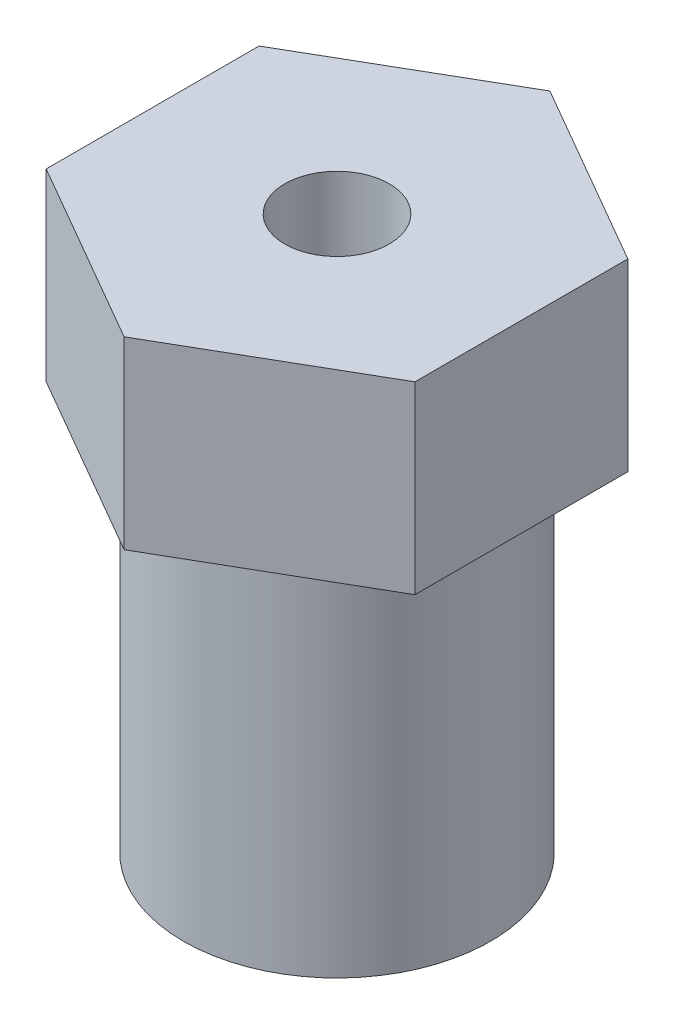
from build123d import *

# Parameters (mm, degrees)
SKETCH1_R                 = 5
SKETCH1_R_2               = 3
BOSS_EXTRUDE1_DEPTH       = 14
BOSS_EXTRUDE2_DEPTH       = 4
M3_CLEARANCE_HOLE1_D      = 3.4
M3_CLEARANCE_HOLE2_REACH  = 25.495
M3_CLEARANCE_HOLE2_BORE_R = 1.7
BOSS_EXTRUDE3_REACH       = 25.495
BOSS_EXTRUDE3_END_RADIUS  = 5
SKETCH11_R                = 2.549362178
SKETCH11_R_2              = 1.7
SKETCH14_R                = 2.549362178
CUT_EXTRUDE2_DEPTH        = 1
BOSS_EXTRUDE4_DEPTH       = 2


with BuildPart() as part:
    # Sketch1 → Boss-Extrude1 (new body)
    with BuildSketch(Plane(origin=(0, 0, 0), x_dir=(1, 0, 0), z_dir=(0, 1, 0))):
        with Locations(Location((0, 0, 0), (0, 0, 270))):
            Circle(SKETCH1_R)
        with Locations(Location((0, 0, 0), (0, 0, 270))):
            Circle(SKETCH1_R_2, mode=Mode.SUBTRACT)
    extrude(amount=BOSS_EXTRUDE1_DEPTH)

    # Sketch2 → Boss-Extrude2 (add)
    with BuildSketch(Plane(origin=(0, 14, 0), x_dir=(1, 0, 0), z_dir=(0, 1, 0))):
        Polygon((0, 6.92820323), (-6, 3.464101615), (-6, -3.464101615), (0, -6.92820323), (6, -3.464101615), (6, 3.464101615), align=None)
    extrude(amount=BOSS_EXTRUDE2_DEPTH)

    # M3 Clearance Hole1 (through all)
    with Locations(Plane(origin=(0, 18, 0), x_dir=(1, 0, 0), z_dir=(0, 1, 0))):
        with Locations((0, 0)):
            Hole(M3_CLEARANCE_HOLE1_D / 2)

    # M3 Clearance Hole2 bore → M3 Clearance Hole2 (cut, up to next)
    with BuildSketch(Plane(origin=(-3, 0, -5.196152423), x_dir=(-0.8660254037844386, 0, 0.5000000000000003), z_dir=(-0.5000000000000002, 0, -0.8660254037844385)), mode=Mode.PRIVATE) as m3_clearance_hole2_sk1:
        with Locations((0, 6)):
            Circle(M3_CLEARANCE_HOLE2_BORE_R)
    m3_clearance_hole2_tool1 = extrude(m3_clearance_hole2_sk1.sketch, amount=-M3_CLEARANCE_HOLE2_REACH, mode=Mode.PRIVATE) & part.part
    add(m3_clearance_hole2_tool1.solids().sort_by_distance((-3, 6, -5.196152))[0], mode=Mode.SUBTRACT)

    # Boss-Extrude3: up to this cylinder (the profile starts outside it)
    boss_extrude3_end = Plane(origin=(0, 6, 0), z_dir=(0, -1, 0)) * Cylinder(BOSS_EXTRUDE3_END_RADIUS, 61.99, mode=Mode.PRIVATE)
    # Sketch11 → Boss-Extrude3 (add, up to the surface)
    with BuildSketch(Plane(origin=(-3, 0, -5.196152423), x_dir=(-0.8660254037844386, 0, 0.5000000000000003), z_dir=(-0.5000000000000002, 0, -0.8660254037844385)), mode=Mode.PRIVATE) as boss_extrude3_sk1:
        with Locations((0, 6)):
            Circle(SKETCH11_R)
        with Locations((0, 6)):
            Circle(SKETCH11_R_2, mode=Mode.SUBTRACT)
    boss_extrude3_tool1 = extrude(boss_extrude3_sk1.sketch, amount=-BOSS_EXTRUDE3_REACH, mode=Mode.PRIVATE) - boss_extrude3_end
    add(boss_extrude3_tool1.solids().sort_by_distance((-0.854634, 6, -6.43478))[0])

    # Sketch14 → Cut-Extrude2 (cut)
    with BuildSketch(Plane(origin=(-3, 0, -5.196152423), x_dir=(-0.8660254037844384, 0, 0.5000000000000004), z_dir=(-0.5000000000000004, 0, -0.8660254037844384))):
        with Locations((0, 6)):
            Circle(SKETCH14_R)
    extrude(amount=-CUT_EXTRUDE2_DEPTH, mode=Mode.SUBTRACT)

    # Sketch19 → Boss-Extrude4 (add)
    with BuildSketch(Plane.XZ.offset(-14)):
        Polygon((0, -6.92820323), (6, -3.464101615), (6, 3.464101615), (0, 6.92820323), (-6, 3.464101615), (-6, -3.464101615), align=None)
    extrude(amount=BOSS_EXTRUDE4_DEPTH)


solid = part.part
